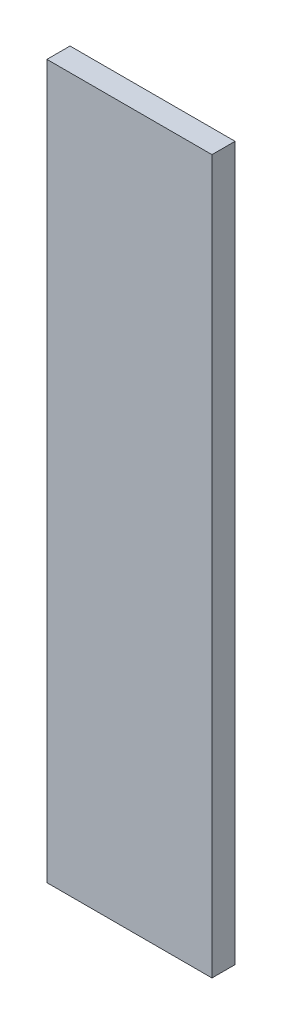
from build123d import *

# Parameters (mm, degrees)
SKETCH1_W           = 250
SKETCH1_H           = 1080
BOSS_EXTRUDE1_DEPTH = 35


with BuildPart() as part:
    # Sketch1 → Boss-Extrude1 (new body)
    with BuildSketch(Plane.XY):
        with Locations((1825, 1090)):
            Rectangle(SKETCH1_W, SKETCH1_H)
    extrude(amount=BOSS_EXTRUDE1_DEPTH)


solid = part.part
